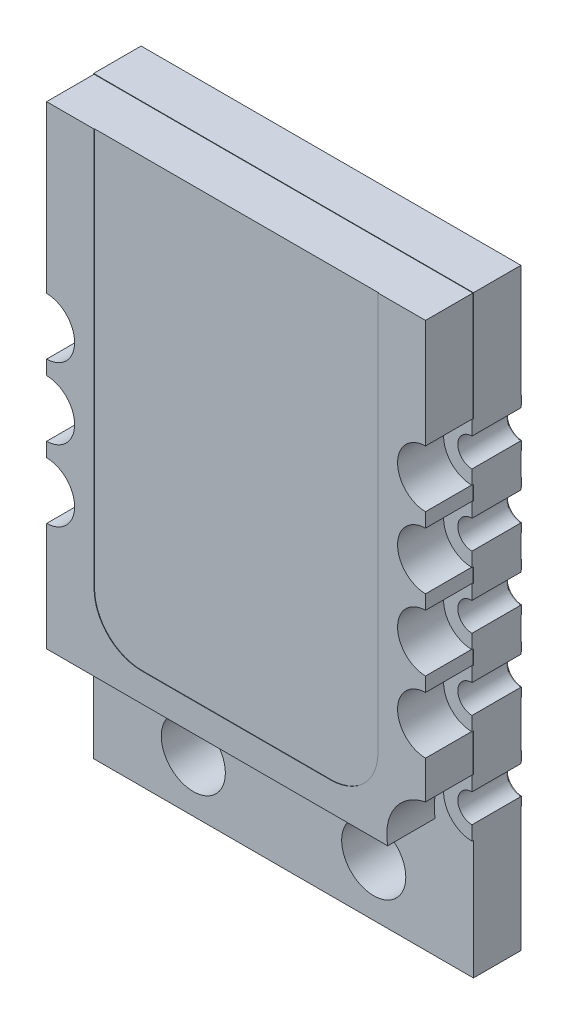
from build123d import *

# Parameters (mm, degrees)
SKETCH1_R           = 0.675
SKETCH1_R_2         = 0.1
BOSS_EXTRUDE1_DEPTH = 1
SKETCH6_W           = 7.115524524
SKETCH6_H           = 8.894405655
BOSS_EXTRUDE5_DEPTH = 1
BOSS_EXTRUDE2_DEPTH = 1
CUT_EXTRUDE1_DEPTH  = 0.01
BOSS_EXTRUDE3_DEPTH = 0.03
BOSS_EXTRUDE4_DEPTH = 0.03


with BuildPart() as part:
    # Sketch1 → Boss-Extrude1 (new body)
    with BuildSketch(Plane.XY):
        with BuildLine():
            Line((27.8, 35.17110115), (27.8, 30.075))
            Line((27.8, 30.075), (35.799949, 30.075))
            Line((35.799949, 30.075), (35.799949, 32.885104042))
            ThreePointArc((35.799949, 32.885104042), (35.501301, 33.1851), (35.799949, 33.485095958))
            Line((35.799949, 33.485095958), (35.799949, 34.879004042))
            ThreePointArc((35.799949, 34.879004042), (35.501301, 35.179), (35.799949, 35.478995958))
            Line((35.799949, 35.478995958), (35.799949, 36.377604042))
            ThreePointArc((35.799949, 36.377604042), (35.501301, 36.6776), (35.799949, 36.977595958))
            Line((35.799949, 36.977595958), (35.799949, 37.876204042))
            ThreePointArc((35.799949, 37.876204042), (35.501301, 38.1762), (35.799949, 38.476195958))
            Line((35.799949, 38.476195958), (35.799949, 39.374804042))
            ThreePointArc((35.799949, 39.374804042), (35.501301, 39.6748), (35.799949, 39.974795958))
            Line((35.799949, 39.974795958), (35.799949, 42.575))
            Line((35.799949, 42.575), (27.8, 42.575))
            Line((27.8, 42.575), (27.8, 38.76829885))
            ThreePointArc((27.8, 38.76829885), (28.012325235, 38.680537367), (28.100299, 38.4683))
            ThreePointArc((28.100299, 38.4683), (28.012325235, 38.256062633), (27.8, 38.16830115))
            Line((27.8, 38.16830115), (27.8, 37.26969885))
            ThreePointArc((27.8, 37.26969885), (28.012325235, 37.181937367), (28.100299, 36.9697))
            ThreePointArc((28.100299, 36.9697), (28.012325235, 36.757462633), (27.8, 36.66970115))
            Line((27.8, 36.66970115), (27.8, 35.77109885))
            ThreePointArc((27.8, 35.77109885), (28.012325235, 35.683337367), (28.100299, 35.4711))
            ThreePointArc((28.100299, 35.4711), (28.012325235, 35.258862633), (27.8, 35.17110115))
        make_face()
        with Locations((29.900001, 31.200001)):
            Circle(SKETCH1_R, mode=Mode.SUBTRACT)
        with Locations((28.6512, 34.2519)):
            Circle(SKETCH1_R_2, mode=Mode.SUBTRACT)
        with Locations((31.242, 33.7312)):
            Circle(SKETCH1_R_2, mode=Mode.SUBTRACT)
        with Locations((33.700001, 31.200001)):
            Circle(SKETCH1_R, mode=Mode.SUBTRACT)
        with Locations((33.9979, 35.6362)):
            Circle(SKETCH1_R_2, mode=Mode.SUBTRACT)
        with Locations((29.4894, 37.4523)):
            Circle(SKETCH1_R_2, mode=Mode.SUBTRACT)
        with Locations((28.6766, 39.4589)):
            Circle(SKETCH1_R_2, mode=Mode.SUBTRACT)
        with Locations((28.6766, 40.1955)):
            Circle(SKETCH1_R_2, mode=Mode.SUBTRACT)
        with Locations((28.5623, 41.0718)):
            Circle(SKETCH1_R_2, mode=Mode.SUBTRACT)
        with Locations((34.417, 40.3987)):
            Circle(SKETCH1_R_2, mode=Mode.SUBTRACT)
        with Locations((35.1282, 41.0718)):
            Circle(SKETCH1_R_2, mode=Mode.SUBTRACT)
    extrude(amount=BOSS_EXTRUDE1_DEPTH)

    # Sketch6 → Boss-Extrude5 (add)
    with BuildSketch(Plane(origin=(0, 0, 0), x_dir=(-1, 0, 0), z_dir=(0, 0, -1))):
        with Locations((-31.874094547, 37.266324599)):
            Rectangle(SKETCH6_W, SKETCH6_H)
    extrude(amount=-BOSS_EXTRUDE5_DEPTH)

    # Sketch2 → Boss-Extrude2 (add)
    with BuildSketch(Plane.XY.offset(1)):
        with BuildLine():
            Line((27.81, 32.583114), (34.9935945, 32.583114))
            ThreePointArc((34.9935945, 32.583114), (35.143737614, 33.347223347), (35.789949, 33.781754006))
            Line((35.789949, 33.781754006), (35.789949, 34.579681377))
            ThreePointArc((35.789949, 34.579681377), (35.201873894, 35.179), (35.789949, 35.778318623))
            Line((35.789949, 35.778318623), (35.789949, 36.078281557))
            ThreePointArc((35.789949, 36.078281557), (35.201874074, 36.6776), (35.789949, 37.276918443))
            Line((35.789949, 37.276918443), (35.789949, 37.576882743))
            ThreePointArc((35.789949, 37.576882743), (35.201875259, 38.1762), (35.789949, 38.775517257))
            Line((35.789949, 38.775517257), (35.789949, 39.075483568))
            ThreePointArc((35.789949, 39.075483568), (35.201876085, 39.6748), (35.789949, 40.274116432))
            Line((35.789949, 40.274116432), (35.789949, 42.565))
            Line((35.789949, 42.565), (27.81, 42.565))
            Line((27.81, 42.565), (27.81, 39.067659783))
            ThreePointArc((27.81, 39.067659783), (28.39973827, 38.4683), (27.81, 37.868940217))
            Line((27.81, 37.868940217), (27.81, 37.569061725))
            ThreePointArc((27.81, 37.569061725), (28.399740212, 36.9697), (27.81, 36.370338275))
            Line((27.81, 36.370338275), (27.81, 36.070463013))
            ThreePointArc((27.81, 36.070463013), (28.3997415, 35.4711), (27.81, 34.871736987))
            Line((27.81, 34.871736987), (27.81, 32.583114))
        make_face()
    extrude(amount=BOSS_EXTRUDE2_DEPTH)

    # Sketch3 → Cut-Extrude1 (cut)
    with BuildSketch(Plane.XY.offset(2)):
        with BuildLine():
            Line((28.81, 42.777701131), (34.789949, 42.777701131))
            Line((34.789949, 42.777701131), (34.789949, 34.183114))
            ThreePointArc((34.789949, 34.183114), (34.497055781, 33.476007219), (33.789949, 33.183114))
            Line((33.789949, 33.183114), (29.81, 33.183114))
            ThreePointArc((29.81, 33.183114), (29.102893219, 33.476007219), (28.81, 34.183114))
            Line((28.81, 34.183114), (28.81, 42.777701131))
        make_face()
    extrude(amount=-CUT_EXTRUDE1_DEPTH, mode=Mode.SUBTRACT)

    # Sketch4 → Boss-Extrude3 (add)
    with BuildSketch(Plane(origin=(0, 0, 0), x_dir=(-1, 0, 0), z_dir=(0, 0, -1))):
        with BuildLine():
            Line((-35.779949, 33.694891216), (-35.779949, 33.504385914))
            ThreePointArc((-35.779949, 33.504385914), (-35.481301, 33.1851), (-35.779949, 32.865814086))
            Line((-35.779949, 32.865814086), (-35.779949, 32.676889963))
            Line((-35.779949, 32.676889963), (-35.038756119, 32.676889963))
            ThreePointArc((-35.038756119, 32.676889963), (-34.529755447, 33.185890801), (-35.038756284, 33.694891473))
            Line((-35.038756284, 33.694891473), (-35.779949, 33.694891216))
        make_face()
        with BuildLine():
            Line((-35.779949, 35.688790945), (-35.779949, 35.498285914))
            ThreePointArc((-35.779949, 35.498285914), (-35.481301, 35.179), (-35.779949, 34.859714086))
            Line((-35.779949, 34.859714086), (-35.779949, 34.670789963))
            Line((-35.779949, 34.670789963), (-35.038756119, 34.670789963))
            ThreePointArc((-35.038756119, 34.670789963), (-34.529755625, 35.179790452), (-35.038756114, 35.688790945))
            Line((-35.038756114, 35.688790945), (-35.779949, 35.688790945))
        make_face()
        with BuildLine():
            Line((-35.779949, 37.187390945), (-35.779949, 36.996885914))
            ThreePointArc((-35.779949, 36.996885914), (-35.481301, 36.6776), (-35.779949, 36.358314086))
            Line((-35.779949, 36.358314086), (-35.779949, 36.169389963))
            Line((-35.779949, 36.169389963), (-35.038756119, 36.169389963))
            ThreePointArc((-35.038756119, 36.169389963), (-34.529755625, 36.678390452), (-35.038756114, 37.187390945))
            Line((-35.038756114, 37.187390945), (-35.779949, 37.187390945))
        make_face()
        with BuildLine():
            Line((-35.779949, 38.685990945), (-35.779949, 38.495485914))
            ThreePointArc((-35.779949, 38.495485914), (-35.481301, 38.1762), (-35.779949, 37.856914086))
            Line((-35.779949, 37.856914086), (-35.779949, 37.667989963))
            Line((-35.779949, 37.667989963), (-35.038756119, 37.667989963))
            ThreePointArc((-35.038756119, 37.667989963), (-34.529755625, 38.176990452), (-35.038756114, 38.685990945))
            Line((-35.038756114, 38.685990945), (-35.779949, 38.685990945))
        make_face()
        with BuildLine():
            Line((-27.82, 37.960089963), (-27.82, 38.148907968))
            ThreePointArc((-27.82, 38.148907968), (-28.120299, 38.4683), (-27.82, 38.787692032))
            Line((-27.82, 38.787692032), (-27.82, 38.978090945))
            Line((-27.82, 38.978090945), (-28.558756031, 38.978090945))
            ThreePointArc((-28.558756031, 38.978090945), (-29.067756767, 38.469589963), (-28.559756031, 37.960089963))
            Line((-28.559756031, 37.960089963), (-27.82, 37.960089963))
        make_face()
        with BuildLine():
            Line((-27.82, 36.461489963), (-27.82, 36.650307968))
            ThreePointArc((-27.82, 36.650307968), (-28.120299, 36.9697), (-27.82, 37.289092032))
            Line((-27.82, 37.289092032), (-27.82, 37.479490946))
            Line((-27.82, 37.479490946), (-28.559755942, 37.479490946))
            ThreePointArc((-28.559755942, 37.479490946), (-29.067756767, 36.969990989), (-28.558756031, 36.461489963))
            Line((-28.558756031, 36.461489963), (-27.82, 36.461489963))
        make_face()
        with BuildLine():
            Line((-35.779949, 40.184590945), (-35.779949, 39.994085914))
            ThreePointArc((-35.779949, 39.994085914), (-35.481301, 39.6748), (-35.779949, 39.355514086))
            Line((-35.779949, 39.355514086), (-35.779949, 39.166589963))
            Line((-35.779949, 39.166589963), (-35.038756119, 39.166589963))
            ThreePointArc((-35.038756119, 39.166589963), (-34.529755625, 39.675590452), (-35.038756114, 40.184590945))
            Line((-35.038756114, 40.184590945), (-35.779949, 40.184590945))
        make_face()
        with BuildLine():
            Line((-27.82, 34.962889963), (-27.82, 35.151707968))
            ThreePointArc((-27.82, 35.151707968), (-28.120299, 35.4711), (-27.82, 35.790492032))
            Line((-27.82, 35.790492032), (-27.82, 35.980890945))
            Line((-27.82, 35.980890945), (-28.558756031, 35.980890945))
            ThreePointArc((-28.558756031, 35.980890945), (-29.067756767, 35.472389963), (-28.559756031, 34.962889963))
            Line((-28.559756031, 34.962889963), (-27.82, 34.962889963))
        make_face()
    extrude(amount=BOSS_EXTRUDE3_DEPTH)

    # Sketch5 → Boss-Extrude4 (add)
    with BuildSketch(Plane.XY.offset(1)):
        with BuildLine():
            Line((35.799949, 39.374804042), (35.799949, 39.075363253))
            ThreePointArc((35.799949, 39.075363253), (35.20186173, 39.6748), (35.799949, 40.274236747))
            Line((35.799949, 40.274236747), (35.799949, 39.974795958))
            ThreePointArc((35.799949, 39.974795958), (35.501301, 39.6748), (35.799949, 39.374804042))
        make_face()
        with BuildLine():
            Line((27.8, 39.067738195), (27.8, 38.76829885))
            ThreePointArc((27.8, 38.76829885), (28.100299, 38.4683), (27.8, 38.16830115))
            Line((27.8, 38.16830115), (27.8, 37.868861805))
            ThreePointArc((27.8, 37.868861805), (28.39973827, 38.4683), (27.8, 39.067738195))
        make_face()
        with BuildLine():
            Line((35.799949, 37.876204042), (35.799949, 37.576763253))
            ThreePointArc((35.799949, 37.576763253), (35.20186173, 38.1762), (35.799949, 38.775636747))
            Line((35.799949, 38.775636747), (35.799949, 38.476195958))
            ThreePointArc((35.799949, 38.476195958), (35.501301, 38.1762), (35.799949, 37.876204042))
        make_face()
        with BuildLine():
            Line((35.799949, 36.377604042), (35.799949, 36.078163253))
            ThreePointArc((35.799949, 36.078163253), (35.20186173, 36.6776), (35.799949, 37.277036747))
            Line((35.799949, 37.277036747), (35.799949, 36.977595958))
            ThreePointArc((35.799949, 36.977595958), (35.501301, 36.6776), (35.799949, 36.377604042))
        make_face()
        with BuildLine():
            Line((35.799949, 34.879004042), (35.799949, 34.579563253))
            ThreePointArc((35.799949, 34.579563253), (35.20186173, 35.179), (35.799949, 35.778436747))
            Line((35.799949, 35.778436747), (35.799949, 35.478995958))
            ThreePointArc((35.799949, 35.478995958), (35.501301, 35.179), (35.799949, 34.879004042))
        make_face()
        with BuildLine():
            Line((35.799949, 32.885104042), (35.799949, 32.585663253))
            ThreePointArc((35.799949, 32.585663253), (35.20186173, 33.1851), (35.799949, 33.784536747))
            Line((35.799949, 33.784536747), (35.799949, 33.485095958))
            ThreePointArc((35.799949, 33.485095958), (35.501301, 33.1851), (35.799949, 32.885104042))
        make_face()
        with BuildLine():
            Line((27.8, 35.168301), (27.8, 34.868861805))
            ThreePointArc((27.8, 34.868861805), (28.399438195, 35.4683), (27.8, 36.067738195))
            Line((27.8, 36.067738195), (27.8, 35.768299))
            ThreePointArc((27.8, 35.768299), (28.099999, 35.4683), (27.8, 35.168301))
        make_face()
        with BuildLine():
            Line((27.8, 36.668301), (27.8, 36.368861805))
            ThreePointArc((27.8, 36.368861805), (28.399438195, 36.9683), (27.8, 37.567738195))
            Line((27.8, 37.567738195), (27.8, 37.268299))
            ThreePointArc((27.8, 37.268299), (28.099999, 36.9683), (27.8, 36.668301))
        make_face()
    extrude(amount=BOSS_EXTRUDE4_DEPTH)


solid = part.part
